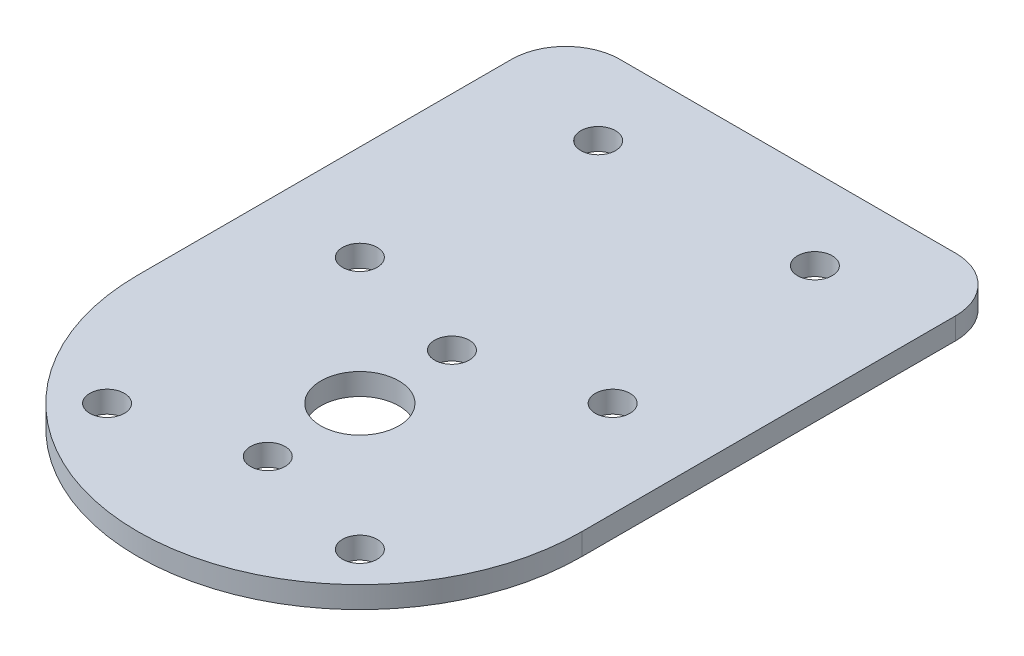
from build123d import *

# Parameters (mm, degrees)
SKETCH_1_R      = 1.6
SKETCH_1_R_2    = 20.5
SKETCH_1_R_3    = 12.5
SKETCH_1_R_4    = 3.6
EXTRUDE_1_DEPTH = 2
FILLET_1_R      = 5


with BuildPart() as part:
    # 草图1 → 凸台-拉伸1 (new body)
    # profile 1 of 3: a face of its own
    with BuildSketch(Plane(origin=(0, 0, 0), x_dir=(1, 0, 0), z_dir=(0, 1, 0))):
        with BuildLine():
            Line((-20.5, 39.5), (-20.5, 0))
            ThreePointArc((-20.5, 0), (0, 20.5), (20.5, 0))
            Line((20.5, 0), (20.5, 39.5))
            Line((20.5, 39.5), (-20.5, 39.5))
        make_face()
        with Locations(Location((-10, 32, 0), (0, 0, 270))):
            Circle(SKETCH_1_R, mode=Mode.SUBTRACT)
        with Locations(Location((10, 32, 0), (0, 0, 270))):
            Circle(SKETCH_1_R, mode=Mode.SUBTRACT)
    # profile 2 of 3: a face of its own
    with BuildSketch(Plane(origin=(0, 0, 0), x_dir=(1, 0, 0), z_dir=(0, 1, 0))):
        Circle(SKETCH_1_R_2)
        with Locations(Location((11.66726189, -11.66726189, 0), (0, 0, 270))):
            Circle(SKETCH_1_R, mode=Mode.SUBTRACT)
        with Locations(Location((11.66726189, 11.66726189, 0), (0, 0, 270))):
            Circle(SKETCH_1_R, mode=Mode.SUBTRACT)
        with Locations(Location((-11.66726189, 11.66726189, 0), (0, 0, 270))):
            Circle(SKETCH_1_R, mode=Mode.SUBTRACT)
        with Locations(Location((-11.66726189, -11.66726189, 0), (0, 0, 270))):
            Circle(SKETCH_1_R, mode=Mode.SUBTRACT)
        Circle(SKETCH_1_R_3, mode=Mode.SUBTRACT)
    # profile 3 of 3: a face of its own
    with BuildSketch(Plane(origin=(0, 0, 0), x_dir=(1, 0, 0), z_dir=(0, 1, 0))):
        Circle(SKETCH_1_R_3)
        with Locations(Location((0, -8.5, 0), (0, 0, 270))):
            Circle(SKETCH_1_R, mode=Mode.SUBTRACT)
        with Locations(Location((0, 8.5, 0), (0, 0, 270))):
            Circle(SKETCH_1_R, mode=Mode.SUBTRACT)
        with Locations(Location((0, 0, 0), (0, 0, 270))):
            Circle(SKETCH_1_R_4, mode=Mode.SUBTRACT)
    extrude(amount=EXTRUDE_1_DEPTH)

    # 圆角1
    fillet_1_edges = [part.edges().sort_by_distance(p)[0] for p in [
        (-20.5, 1, -39.5),
        (20.5, 1, -39.5),
    ]]
    fillet(fillet_1_edges, radius=FILLET_1_R)


solid = part.part
